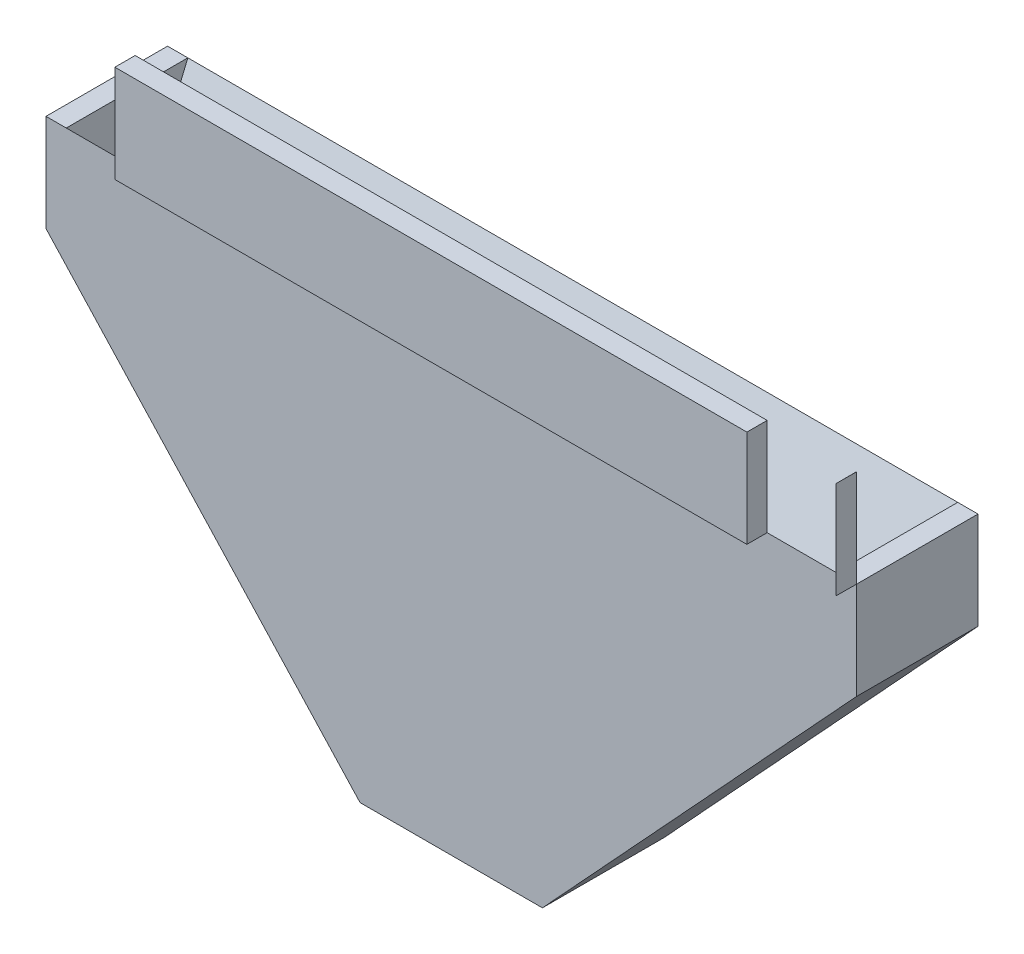
from build123d import *

# Parameters (mm, degrees)
SKETCH1_W               = 200
SKETCH1_H               = 24
BOSS_EXTRUDE1_DEPTH     = 30
CUT_EXTRUDE1_DEPTH      = 204.656573672
CUT_EXTRUDE1_DEPTH_BACK = 195
SKETCH3_W               = 5
SKETCH3_H               = 30
BOSS_EXTRUDE2_DEPTH     = 24
BOSS_EXTRUDE3_DEPTH     = 24
SKETCH10_W              = 22
SKETCH10_H              = 24
CUT_EXTRUDE8_DEPTH      = 24
SKETCH12_W              = 22
SKETCH12_H              = 24
CUT_EXTRUDE9_DEPTH      = 24
BOSS_EXTRUDE4_DEPTH     = 30
CUT_EXTRUDE13_DEPTH     = 20
SKETCH16_W              = 190
SKETCH16_H              = 10
BOSS_EXTRUDE5_DEPTH     = 84
CUT_EXTRUDE15_DEPTH     = 84
CUT_EXTRUDE16_DEPTH     = 84
CUT_EXTRUDE17_DEPTH     = 84


with BuildPart() as part:
    # Sketch1 → Boss-Extrude1 (new body)
    with BuildSketch(Plane.XY):
        with Locations((100, -12)):
            Rectangle(SKETCH1_W, SKETCH1_H)
    extrude(amount=BOSS_EXTRUDE1_DEPTH)

    # Sketch2 → Cut-Extrude1 (cut, two sides: drawn at the far end of the back side and taken through both)
    with BuildSketch(Plane(origin=(200, 0, 0), x_dir=(0, 0, -1), z_dir=(1, 0, 0)).offset(-CUT_EXTRUDE1_DEPTH_BACK)):
        Polygon((0, 0), (-30, 0), (-20, -24), (-10, -24), align=None)
    extrude(amount=CUT_EXTRUDE1_DEPTH + CUT_EXTRUDE1_DEPTH_BACK, mode=Mode.SUBTRACT)

    # Sketch3 → Boss-Extrude2 (add)
    with BuildSketch(Plane(origin=(0, -24, 0), x_dir=(-1, 0, 0), z_dir=(0, -1, 0))):
        with Locations((-197.5, -15)):
            Rectangle(SKETCH3_W, SKETCH3_H)
    extrude(amount=-BOSS_EXTRUDE2_DEPTH)

    # Sketch13 → Boss-Extrude4 (add)
    with BuildSketch(Plane(origin=(0, 0, 0), x_dir=(-1, 0, 0), z_dir=(0, 0, -1))):
        Polygon((-200, -24), (-122.5, -107.919158747), (-77.5, -107.919158747), (0, -24), (-100, -24), align=None)
    extrude(amount=-BOSS_EXTRUDE4_DEPTH)

    # Sketch15 → Cut-Extrude13 (cut)
    with BuildSketch(Plane(origin=(0, 0, 0), x_dir=(-1, 0, 0), z_dir=(0, 0, -1))):
        Polygon((-5, -24), (-195, -24), (-117.5, -107.919158747), (-82.5, -107.919158747), align=None)
    extrude(amount=-CUT_EXTRUDE13_DEPTH, mode=Mode.SUBTRACT)

    # Sketch16 → Boss-Extrude5 (add)
    with BuildSketch(Plane.XZ.offset(24)):
        with Locations((100, 5)):
            Rectangle(SKETCH16_W, SKETCH16_H)
    extrude(amount=BOSS_EXTRUDE5_DEPTH)

    # Sketch17 → Cut-Extrude15 (cut)
    with BuildSketch(Plane.XY.offset(10)):
        Polygon((5, -29.414139274), (77.5, -107.919158747), (77.5, -132.289911092), (5, -132.289911092), (5, -108), align=None)
    extrude(amount=-CUT_EXTRUDE15_DEPTH, mode=Mode.SUBTRACT)

    # Sketch18 → Cut-Extrude16 (cut)
    with BuildSketch(Plane.XY.offset(10)):
        Polygon((195, -29.414139274), (122.5, -107.919158747), (122.856459542, -124.209438819), (195, -124.209438819), align=None)
    extrude(amount=-CUT_EXTRUDE16_DEPTH, mode=Mode.SUBTRACT)

    # Sketch19 → Cut-Extrude17 (cut)
    with BuildSketch(Plane.XY.offset(10)):
        Polygon((82.5, -107.919158747), (77.5, -107.919158747), (77.5, -108), (122.501768947, -108), (122.5, -107.919158747), (117.5, -107.919158747), align=None)
    extrude(amount=-CUT_EXTRUDE17_DEPTH, mode=Mode.SUBTRACT)


with BuildPart() as body_2:
    # Sketch5 → Boss-Extrude3 (new body)
    with BuildSketch(Plane(origin=(0, 0, 0), x_dir=(1, 0, 0), z_dir=(0, 1, 0))):
        Polygon((0, -30), (0, -35), (199.967386175, -35), (200, -30), align=None)
    extrude(amount=BOSS_EXTRUDE3_DEPTH)

    # Sketch10 → Cut-Extrude8 (cut)
    with BuildSketch(Plane.XY.offset(35)):
        with Locations((188.967386175, 12)):
            Rectangle(SKETCH10_W, SKETCH10_H)
    extrude(amount=-CUT_EXTRUDE8_DEPTH, mode=Mode.SUBTRACT)


with BuildPart() as cut_extrude8_piece_1:
    # of the separate pieces the step leaves, piece 1, a body of its own (cut_extrude8_pieces)
    add(body_2.part.solids().sort_by_distance((0, 0, 30))[0])

    # Sketch12 → Cut-Extrude9 (cut)
    with BuildSketch(Plane(origin=(0, 0, 30), x_dir=(-1, 0, 0), z_dir=(0, 0, -1))):
        with Locations((-11, 12)):
            Rectangle(SKETCH12_W, SKETCH12_H)
    extrude(amount=-CUT_EXTRUDE9_DEPTH, mode=Mode.SUBTRACT)


with BuildPart() as cut_extrude8_piece_2:
    # of the separate pieces the step leaves, piece 2, a body of its own (cut_extrude8_pieces)
    add(body_2.part.solids().sort_by_distance((200, 0, 30))[0])


solid = Compound([part.part, cut_extrude8_piece_1.part, cut_extrude8_piece_2.part])
